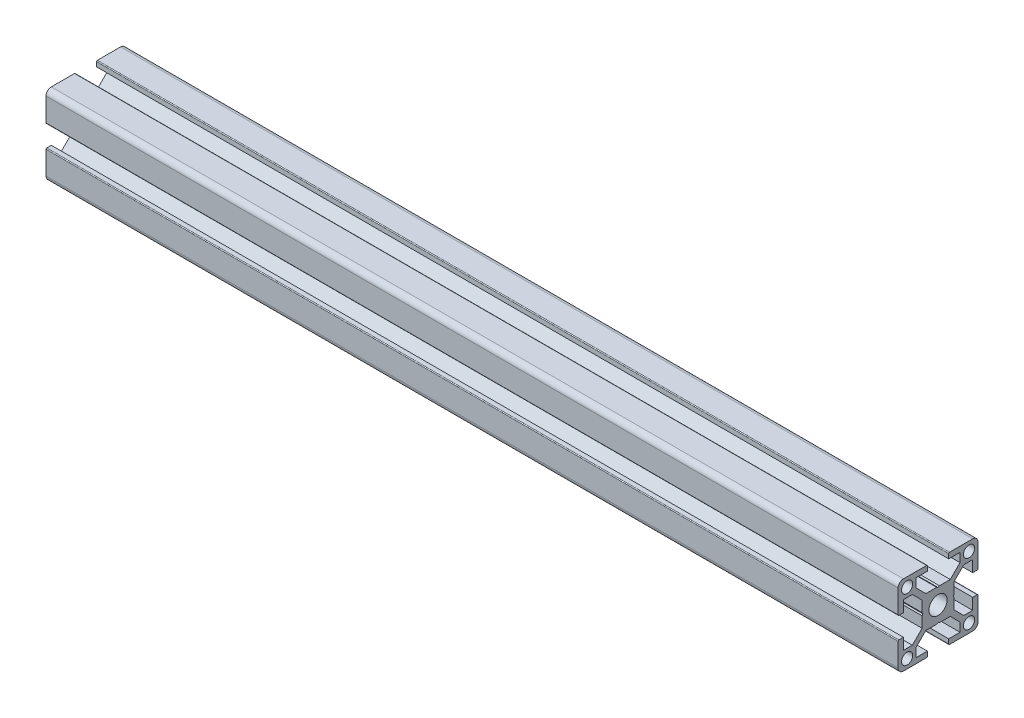
from build123d import *

# Parameters (mm, degrees)
SKETCH_1_R              = 2.1
SKETCH_1_R_2            = 3.4
F_30XS6_30X30S6_1_DEPTH = 320


with BuildPart() as part:
    # 草图1 → 30xs6 30X30S6(1) (new body)
    with BuildSketch(Plane.YZ):
        with BuildLine():
            Line((-14.7, 4), (-13, 4))
            Line((-13, 4), (-13, 8.25))
            Line((-13, 8.25), (-9.664213562, 8.25))
            Line((-9.664213562, 8.25), (-6, 4.585786438))
            Line((-6, 4.585786438), (-6, 0.519615242))
            Line((-6, 0.519615242), (-5.7, 0))
            Line((-5.7, 0), (-6, -0.519615242))
            Line((-6, -0.519615242), (-6, -4.585786438))
            Line((-6, -4.585786438), (-9.664213562, -8.25))
            Line((-9.664213562, -8.25), (-13, -8.25))
            Line((-13, -8.25), (-13, -4))
            Line((-13, -4), (-14.7, -4))
            ThreePointArc((-14.7, -4), (-14.912132034, -4.087867966), (-15, -4.3))
            Line((-15, -4.3), (-15, -13))
            ThreePointArc((-15, -13), (-14.414213562, -14.414213562), (-13, -15))
            Line((-13, -15), (-4.3, -15))
            ThreePointArc((-4.3, -15), (-4.087867966, -14.912132034), (-4, -14.7))
            Line((-4, -14.7), (-4, -13))
            Line((-4, -13), (-8.25, -13))
            Line((-8.25, -13), (-8.25, -9.664213562))
            Line((-8.25, -9.664213562), (-4.585786438, -6))
            Line((-4.585786438, -6), (-0.519615242, -6))
            Line((-0.519615242, -6), (0, -5.7))
            Line((0, -5.7), (0.519615242, -6))
            Line((0.519615242, -6), (4.585786438, -6))
            Line((4.585786438, -6), (8.25, -9.664213562))
            Line((8.25, -9.664213562), (8.25, -13))
            Line((8.25, -13), (4, -13))
            Line((4, -13), (4, -14.7))
            ThreePointArc((4, -14.7), (4.087867966, -14.912132034), (4.3, -15))
            Line((4.3, -15), (13, -15))
            ThreePointArc((13, -15), (14.414213562, -14.414213562), (15, -13))
            Line((15, -13), (15, -4.3))
            ThreePointArc((15, -4.3), (14.912132034, -4.087867966), (14.7, -4))
            Line((14.7, -4), (13, -4))
            Line((13, -4), (13, -8.25))
            Line((13, -8.25), (9.664213562, -8.25))
            Line((9.664213562, -8.25), (6, -4.585786438))
            Line((6, -4.585786438), (6, -0.519615242))
            Line((6, -0.519615242), (5.7, 0))
            Line((5.7, 0), (6, 0.519615242))
            Line((6, 0.519615242), (6, 4.585786438))
            Line((6, 4.585786438), (9.664213562, 8.25))
            Line((9.664213562, 8.25), (13, 8.25))
            Line((13, 8.25), (13, 4))
            Line((13, 4), (14.7, 4))
            ThreePointArc((14.7, 4), (14.912132034, 4.087867966), (15, 4.3))
            Line((15, 4.3), (15, 13))
            ThreePointArc((15, 13), (14.414213562, 14.414213562), (13, 15))
            Line((13, 15), (4.3, 15))
            ThreePointArc((4.3, 15), (4.087867966, 14.912132034), (4, 14.7))
            Line((4, 14.7), (4, 13))
            Line((4, 13), (8.25, 13))
            Line((8.25, 13), (8.25, 9.664213562))
            Line((8.25, 9.664213562), (4.585786438, 6))
            Line((4.585786438, 6), (0.519615242, 6))
            Line((0.519615242, 6), (0, 5.7))
            Line((0, 5.7), (-0.519615242, 6))
            Line((-0.519615242, 6), (-4.585786438, 6))
            Line((-4.585786438, 6), (-8.25, 9.664213562))
            Line((-8.25, 9.664213562), (-8.25, 13))
            Line((-8.25, 13), (-4, 13))
            Line((-4, 13), (-4, 14.7))
            ThreePointArc((-4, 14.7), (-4.087867966, 14.912132034), (-4.3, 15))
            Line((-4.3, 15), (-13, 15))
            ThreePointArc((-13, 15), (-14.414213562, 14.414213562), (-15, 13))
            Line((-15, 13), (-15, 4.3))
            ThreePointArc((-15, 4.3), (-14.912132034, 4.087867966), (-14.7, 4))
        make_face()
        with Locations((11.625, 11.625)):
            Circle(SKETCH_1_R, mode=Mode.SUBTRACT)
        with Locations((11.625, -11.625)):
            Circle(SKETCH_1_R, mode=Mode.SUBTRACT)
        Circle(SKETCH_1_R_2, mode=Mode.SUBTRACT)
        with Locations((-11.625, -11.625)):
            Circle(SKETCH_1_R, mode=Mode.SUBTRACT)
        with Locations((-11.625, 11.625)):
            Circle(SKETCH_1_R, mode=Mode.SUBTRACT)
    extrude(amount=F_30XS6_30X30S6_1_DEPTH)


solid = part.part
